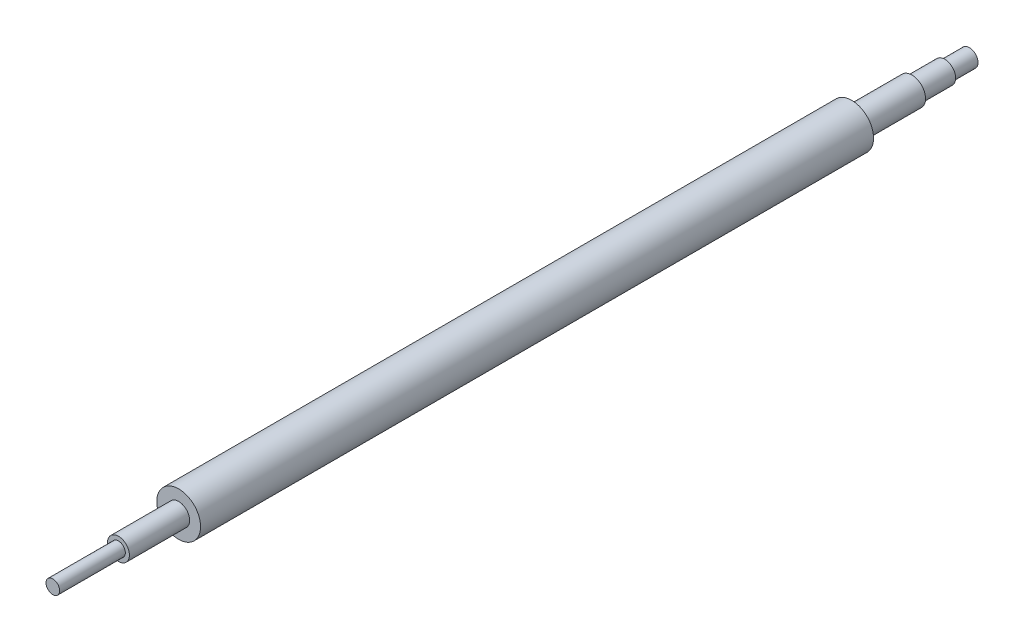
from build123d import *

# Parameters (mm, degrees)
SKETCH_1_R      = 8
EXTRUDE_1_DEPTH = 246
SKETCH_2_R      = 4
EXTRUDE_2_DEPTH = 22
SKETCH_4_R      = 5
EXTRUDE_3_DEPTH = 22
SKETCH_5_R      = 2.5
EXTRUDE_4_DEPTH = 24
SKETCH_9_R      = 4
EXTRUDE_5_DEPTH = 12
SKETCH_10_R     = 3.175
EXTRUDE_6_DEPTH = 9


with BuildPart() as part:
    # 草图1 → 凸台-拉伸1 (new body)
    with BuildSketch(Plane.XY):
        Circle(SKETCH_1_R)
    extrude(amount=EXTRUDE_1_DEPTH)


with BuildPart() as body_2:
    # 草图2 → 凸台-拉伸2 (new body)
    with BuildSketch(Plane.XY.offset(246)):
        Circle(SKETCH_2_R)
    extrude(amount=EXTRUDE_2_DEPTH)


with BuildPart() as body_3:
    # 草图4 → 凸台-拉伸3 (new body)
    with BuildSketch(Plane(origin=(0, 0, 0), x_dir=(-1, 0, 0), z_dir=(0, 0, -1))):
        Circle(SKETCH_4_R)
    extrude(amount=EXTRUDE_3_DEPTH)

    # 草图9 → 凸台-拉伸5 (add)
    with BuildSketch(Plane(origin=(0, 0, -22), x_dir=(-1, 0, 0), z_dir=(0, 0, -1))):
        Circle(SKETCH_9_R)
    extrude(amount=EXTRUDE_5_DEPTH)

    # 草图10 → 凸台-拉伸6 (add)
    with BuildSketch(Plane(origin=(0, 0, -34), x_dir=(-1, 0, 0), z_dir=(0, 0, -1))):
        Circle(SKETCH_10_R)
    extrude(amount=EXTRUDE_6_DEPTH)


with BuildPart() as body_4:
    # 草图5 → 凸台-拉伸4 (new body)
    with BuildSketch(Plane.XY.offset(268)):
        Circle(SKETCH_5_R)
    extrude(amount=EXTRUDE_4_DEPTH)


solid = Compound([part.part, body_2.part, body_3.part, body_4.part])
